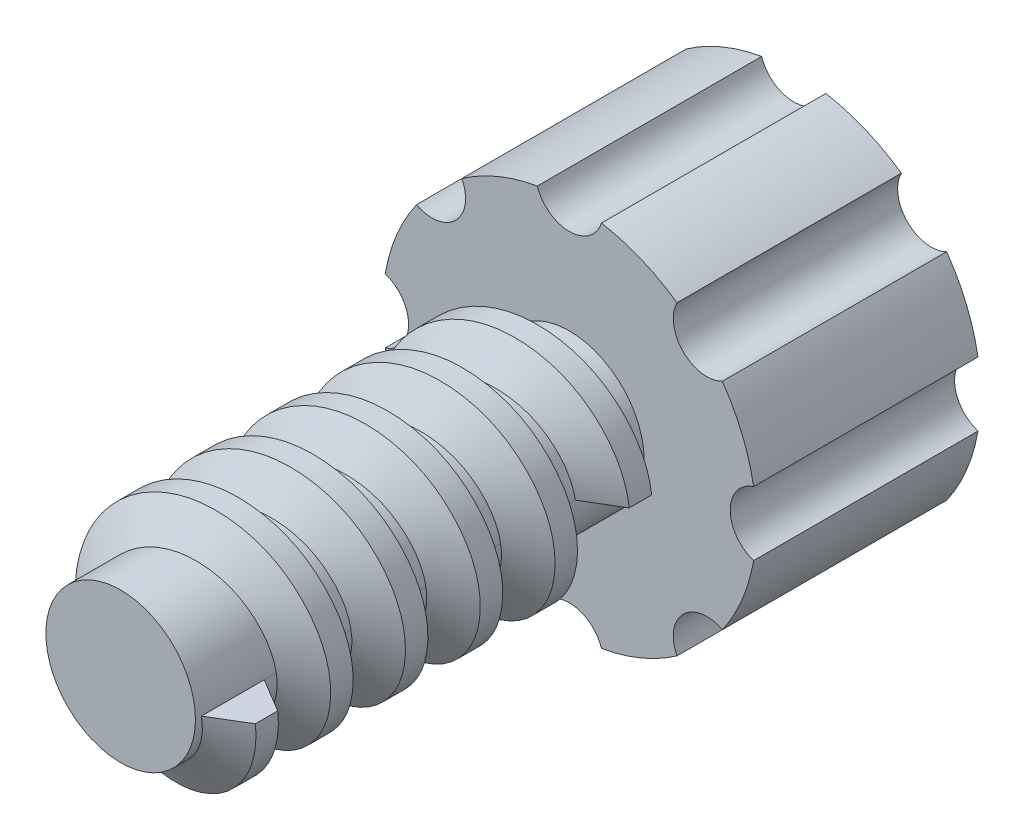
from build123d import *

# Parameters (mm, degrees)
COMPACT_HEAD_D5_H3_START             = -3
SKETCH1_R                            = 2.5
COMPACT_HEAD_D5_H3_DEPTH             = 3
SKETCH2_R                            = 1
PRINTED_SCREW_CORE_D2_DEPTH          = 6
ACTUAL_PRINTED_THREAD_D2P9_P1_PITCH  = 1
ACTUAL_PRINTED_THREAD_D2P9_P1_HEIGHT = 5
ACTUAL_PRINTED_THREAD_D2P9_P1_RADIUS = 0.98
SMALL_FINGER_GRIP_FLUTES_START       = -3
SKETCH4_R                            = 0.45
SMALL_FINGER_GRIP_FLUTES_DEPTH       = 3


with BuildPart() as part:
    # Sketch1 → Compact_head_D5_H3 (new body)
    with BuildSketch(Plane.XY.offset(COMPACT_HEAD_D5_H3_START)):
        Circle(SKETCH1_R)
    extrude(amount=COMPACT_HEAD_D5_H3_DEPTH)

    # Sketch2 → Printed_screw_core_D2 (add)
    with BuildSketch(Plane.XY):
        Circle(SKETCH2_R)
    extrude(amount=PRINTED_SCREW_CORE_D2_DEPTH)

    # Actual_printed_thread_D2p9_P1: sweep along a helix
    with BuildLine() as actual_printed_thread_d2p9_p1_path:
        Helix(ACTUAL_PRINTED_THREAD_D2P9_P1_PITCH, ACTUAL_PRINTED_THREAD_D2P9_P1_HEIGHT, ACTUAL_PRINTED_THREAD_D2P9_P1_RADIUS, center=(0, 0, 0.5), direction=(0, 0, 1))
    # 3DSketch1 → Actual_printed_thread_D2p9_P1 (sweep)
    with BuildSketch(Plane(origin=(0.95, 0, 0.05), x_dir=(0, 0, 1), z_dir=(0, 1, 0))):
        Polygon((0, 0), (0.3, 0.5), (0.6, 0.5), (0.9, 0), align=None)
    sweep(path=actual_printed_thread_d2p9_p1_path.line, is_frenet=True)

    # Sketch4 → Small_finger_grip_flutes (cut)
    with BuildSketch(Plane.XY.offset(SMALL_FINGER_GRIP_FLUTES_START)):
        with Locations((2.6, 0)):
            Circle(SKETCH4_R)
        with Locations((1.838477631, 1.838477631)):
            Circle(SKETCH4_R)
        with Locations((0, 2.6)):
            Circle(SKETCH4_R)
        with Locations((-1.838477631, 1.838477631)):
            Circle(SKETCH4_R)
        with Locations((-2.6, 0)):
            Circle(SKETCH4_R)
        with Locations((-1.838477631, -1.838477631)):
            Circle(SKETCH4_R)
        with Locations((0, -2.6)):
            Circle(SKETCH4_R)
        with Locations((1.838477631, -1.838477631)):
            Circle(SKETCH4_R)
    extrude(amount=SMALL_FINGER_GRIP_FLUTES_DEPTH, mode=Mode.SUBTRACT)


solid = part.part
